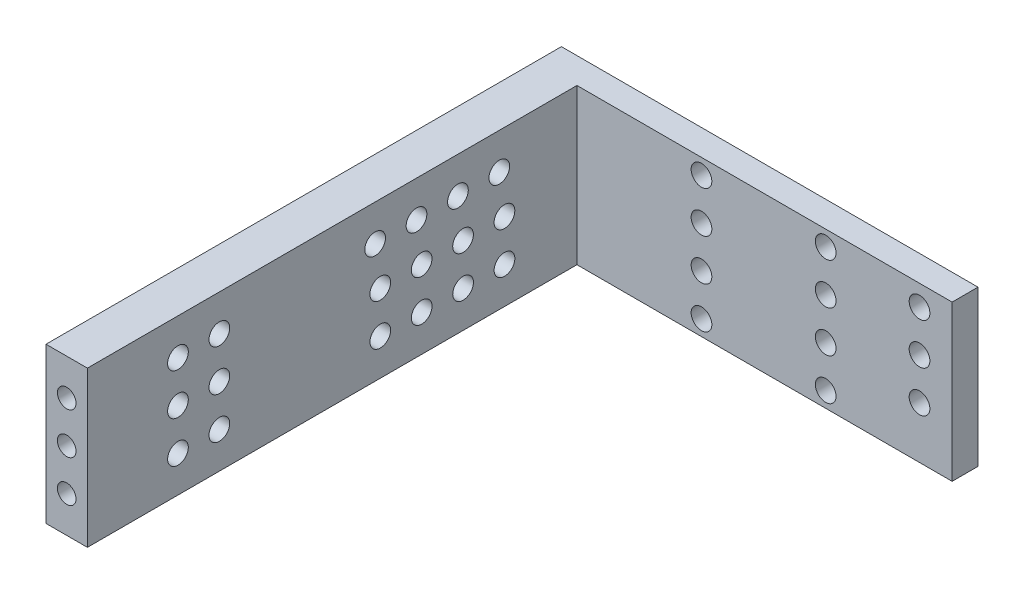
from build123d import *

# Parameters (mm, degrees)
EXTRUDE_1_DEPTH     = 30
SKETCH_3_R          = 2
CUT_EXTRUDE_2_DEPTH = 10
SKETCH_4_R          = 2
CUT_EXTRUDE_3_DEPTH = 10
SKETCH_2_R          = 1.8
CUT_EXTRUDE_4_DEPTH = 20
SKETCH_5_W          = 8
SKETCH_5_H          = 7.5
CUT_EXTRUDE_5_DEPTH = 30
SKETCH_6_R          = 2
CUT_EXTRUDE_6_DEPTH = 10


with BuildPart() as part:
    # 草圖1 → 填料-伸長1 (new body)
    with BuildSketch(Plane(origin=(0, 0, 0), x_dir=(1, 0, 0), z_dir=(0, 1, 0))):
        Polygon((0, 0), (0, 107.1), (80.5, 107.1), (80.5, 102.1), (8, 102.1), (8, 0), align=None)
    extrude(amount=EXTRUDE_1_DEPTH)

    # 草圖3 → 除料-伸長2 (cut)
    with BuildSketch(Plane.ZY):
        with Locations((-25, 23)):
            Circle(SKETCH_3_R)
        with Locations((-25, 15)):
            Circle(SKETCH_3_R)
        with Locations((-25, 7)):
            Circle(SKETCH_3_R)
        with Locations((-33, 23)):
            Circle(SKETCH_3_R)
        with Locations((-33, 15)):
            Circle(SKETCH_3_R)
        with Locations((-33, 7)):
            Circle(SKETCH_3_R)
        with Locations((-63.1, 23)):
            Circle(SKETCH_3_R)
        with Locations((-64.092277877, 15.061776986)):
            Circle(SKETCH_3_R)
        with Locations((-64.099940822, 7.061780656)):
            Circle(SKETCH_3_R)
        with Locations((-71.1, 23)):
            Circle(SKETCH_3_R)
        with Locations((-72.092277877, 15.061776986)):
            Circle(SKETCH_3_R)
        with Locations((-72.099940822, 7.061780656)):
            Circle(SKETCH_3_R)
        with Locations((-79.1, 23)):
            Circle(SKETCH_3_R)
        with Locations((-80.092277877, 15.061776986)):
            Circle(SKETCH_3_R)
        with Locations((-80.099940822, 7.061780656)):
            Circle(SKETCH_3_R)
        with Locations((-87.1, 23)):
            Circle(SKETCH_3_R)
        with Locations((-88.092277877, 15.061776986)):
            Circle(SKETCH_3_R)
        with Locations((-88.099940822, 7.061780656)):
            Circle(SKETCH_3_R)
    extrude(amount=-CUT_EXTRUDE_2_DEPTH, mode=Mode.SUBTRACT)

    # 草圖4 → 除料-伸長3 (cut)
    with BuildSketch(Plane(origin=(0, 0, -107.1), x_dir=(-1, 0, 0), z_dir=(0, 0, -1))):
        with Locations((-74.2, 26)):
            Circle(SKETCH_4_R)
        with Locations((-74.2, 18)):
            Circle(SKETCH_4_R)
        with Locations((-74.2, 10)):
            Circle(SKETCH_4_R)
    extrude(amount=-CUT_EXTRUDE_3_DEPTH, mode=Mode.SUBTRACT)

    # 草圖2 → 除料-伸長4 (cut)
    with BuildSketch(Plane.XY):
        with Locations((4, 23)):
            Circle(SKETCH_2_R)
        with Locations((4, 7)):
            Circle(SKETCH_2_R)
        with Locations((4, 15)):
            Circle(SKETCH_2_R)
    extrude(amount=-CUT_EXTRUDE_4_DEPTH, mode=Mode.SUBTRACT)

    # 草圖5 → 除料-伸長5 (cut)
    with BuildSketch(Plane(origin=(0, 30, 0), x_dir=(1, 0, 0), z_dir=(0, 1, 0))):
        with Locations((4, 3.75)):
            Rectangle(SKETCH_5_W, SKETCH_5_H)
    extrude(amount=-CUT_EXTRUDE_5_DEPTH, mode=Mode.SUBTRACT)

    # 草圖6 → 除料-伸長6 (cut)
    with BuildSketch(Plane(origin=(0, 0, -107.1), x_dir=(-1, 0, 0), z_dir=(0, 0, -1))):
        with Locations((-56.067683871, 27)):
            Circle(SKETCH_6_R)
        with Locations((-56.067683871, 19)):
            Circle(SKETCH_6_R)
        with Locations((-56.067683871, 11)):
            Circle(SKETCH_6_R)
        with Locations((-32.067683871, 27)):
            Circle(SKETCH_6_R)
        with Locations((-32.067683871, 19)):
            Circle(SKETCH_6_R)
        with Locations((-32.067683871, 11)):
            Circle(SKETCH_6_R)
        with Locations((-56.067683871, 3)):
            Circle(SKETCH_6_R)
        with Locations((-32.067683871, 3)):
            Circle(SKETCH_6_R)
    extrude(amount=-CUT_EXTRUDE_6_DEPTH, mode=Mode.SUBTRACT)


solid = part.part
